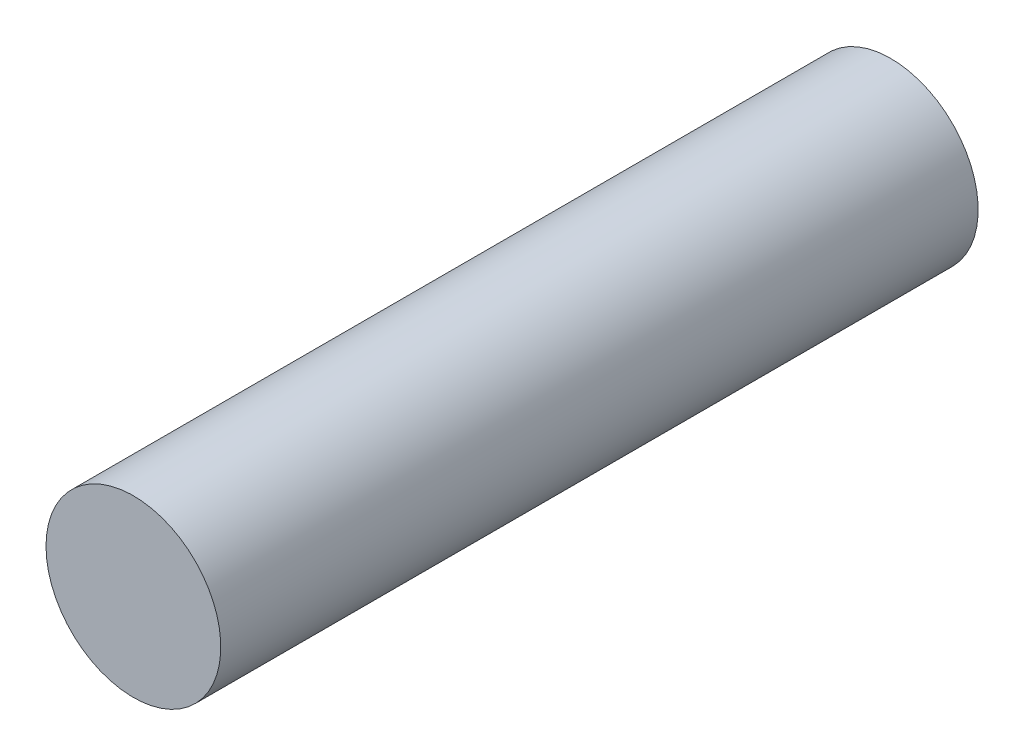
from build123d import *

# Parameters (mm, degrees)
SKETCH_1_R      = 3
EXTRUDE_1_DEPTH = 26


with BuildPart() as part:
    # 스케치1 → 보스-돌출1 (new body)
    with BuildSketch(Plane.XY):
        with Locations(Location((0, 0, 0), (0, 0, 180))):
            Circle(SKETCH_1_R)
    extrude(amount=EXTRUDE_1_DEPTH)


solid = part.part
